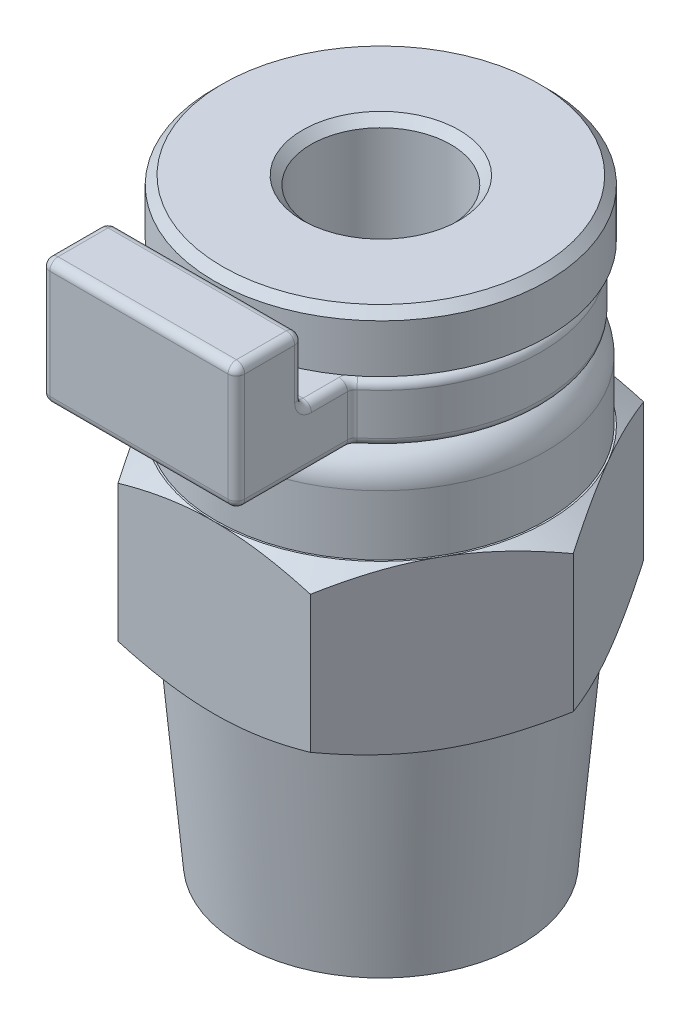
from build123d import *

# Parameters (mm, degrees)
BOSS_EXTRUDE1_DEPTH     = 2.5
SKETCH2_OUTSIDE_W       = 26.462
SKETCH2_OUTSIDE_H       = 24.914
SKETCH2_OUTSIDE_R       = 5
CUT_EXTRUDE4_DEPTH      = 2.8
CUT_EXTRUDE4_DRAFT      = -60
MIRROR1_COPY_1_SKETCH_W = 26.462
MIRROR1_COPY_1_SKETCH_H = 24.914
MIRROR1_COPY_1_SKETCH_R = 5
MIRROR1_COPY_1_DEPTH    = 2.8
MIRROR1_COPY_1_DRAFT    = -60
SKETCH3_R               = 4.95
BOSS_EXTRUDE2_DEPTH     = 2.8
FILLET1_R               = 1
SKETCH4_R               = 2.8
BOSS_EXTRUDE3_DEPTH     = 2
SKETCH6_R               = 5
BOSS_EXTRUDE4_DEPTH     = 1.7
SKETCH8_R               = 4.75
BOSS_EXTRUDE5_DEPTH     = 6.4
BOSS_EXTRUDE5_TAPER     = 5
SKETCH7_R               = 2.1
CUT_EXTRUDE5_DEPTH      = 20.461329269
CHAMFER1_SIZE           = 0.25
BOSS_EXTRUDE6_DEPTH     = 1.75
SKETCH10_W              = 5.85
SKETCH10_H              = 2
BOSS_EXTRUDE7_DEPTH     = 2
FILLET2_R               = 0.25


with BuildPart() as part:
    # Sketch1 → Boss-Extrude1 (new, symmetric)
    with BuildSketch(Plane(origin=(0, 0, 0), x_dir=(1, 0, 0), z_dir=(0, 1, 0))):
        Polygon((5.773502692, 0), (2.886751346, 5), (-2.886751346, 5), (-5.773502692, 0), (-2.886751346, -5), (2.886751346, -5), align=None)
    extrude(amount=BOSS_EXTRUDE1_DEPTH, both=True)


with BuildPart() as cut_extrude4_tool:
    # Sketch2 outside → Cut-Extrude4 (with draft: the straight prism first)
    with BuildSketch(Plane(origin=(0, 2.5, 0), x_dir=(1, 0, 0), z_dir=(0, 1, 0))):
        Rectangle(SKETCH2_OUTSIDE_W, SKETCH2_OUTSIDE_H)
        Circle(SKETCH2_OUTSIDE_R, mode=Mode.SUBTRACT)
    extrude(amount=-CUT_EXTRUDE4_DEPTH)
    # Cut-Extrude4: the draft: its side faces are tilted about the plane it starts from
    cut_extrude4_sides = [cut_extrude4_tool.faces().sort_by_distance(p)[0] for p in [
        (0, 1.1, 12.457),
        (13.231, 1.1, 0),
        (0, 1.1, -12.457),
        (-13.231, 1.1, 0),
        (-5, 1.1, 0),
    ]]
    draft(cut_extrude4_sides, Plane(origin=(0, 2.5, 0), x_dir=(1, 0, 0), z_dir=(0, 1, 0)), CUT_EXTRUDE4_DRAFT)


with BuildPart() as part_1:
    add(part.part)

    # Cut-Extrude4: cut by cut_extrude4_tool
    add(cut_extrude4_tool.part, mode=Mode.SUBTRACT)


with BuildPart() as mirror1_copy_1_tool:
    # Mirror1 copy 1 sketch → Mirror1 copy 1 (with draft: the straight prism first)
    with BuildSketch(Plane.XZ.offset(2.5)):
        Rectangle(MIRROR1_COPY_1_SKETCH_W, MIRROR1_COPY_1_SKETCH_H)
        Circle(MIRROR1_COPY_1_SKETCH_R, mode=Mode.SUBTRACT)
    extrude(amount=-MIRROR1_COPY_1_DEPTH)
    # Mirror1 copy 1: the draft: its side faces are tilted about the plane it starts from
    mirror1_copy_1_sides = [mirror1_copy_1_tool.faces().sort_by_distance(p)[0] for p in [
        (0, -1.1, 12.457),
        (13.231, -1.1, 0),
        (0, -1.1, -12.457),
        (-13.231, -1.1, 0),
        (-5, -1.1, 0),
    ]]
    draft(mirror1_copy_1_sides, Plane.XZ.offset(2.5), MIRROR1_COPY_1_DRAFT)


with BuildPart() as part_2:
    add(part_1.part)

    # Mirror1 copy 1: cut by mirror1_copy_1_tool
    add(mirror1_copy_1_tool.part, mode=Mode.SUBTRACT)

    # Sketch3 → Boss-Extrude2 (add)
    with BuildSketch(Plane(origin=(0, 2.5, 0), x_dir=(1, 0, 0), z_dir=(0, 1, 0))):
        with Locations(Location((0, 0, 0), (0, 0, 270))):
            Circle(SKETCH3_R)
    extrude(amount=BOSS_EXTRUDE2_DEPTH)

    # Fillet1
    fillet1_edges = [part_2.edges().sort_by_distance(p)[0] for p in [
        (0, 5.3, -4.95),
    ]]
    fillet(fillet1_edges, radius=FILLET1_R)

    # Sketch8 → Boss-Extrude5 (add)
    with BuildSketch(Plane.XZ.offset(2.5)):
        Circle(SKETCH8_R)
    extrude(amount=BOSS_EXTRUDE5_DEPTH, taper=BOSS_EXTRUDE5_TAPER)


with BuildPart() as body_2:
    # Sketch4 → Boss-Extrude3 (new body)
    with BuildSketch(Plane(origin=(0, 5.3, 0), x_dir=(1, 0, 0), z_dir=(0, 1, 0))):
        with Locations(Location((0, 0, 0), (0, 0, 270))):
            Circle(SKETCH4_R)
    extrude(amount=BOSS_EXTRUDE3_DEPTH)

    # Sketch6 → Boss-Extrude4 (add)
    with BuildSketch(Plane(origin=(0, 7.3, 0), x_dir=(1, 0, 0), z_dir=(0, 1, 0))):
        with Locations(Location((0, 0, 0), (0, 0, 270))):
            Circle(SKETCH6_R)
    extrude(amount=BOSS_EXTRUDE4_DEPTH)


with BuildPart() as cut_extrude5_tool:
    # Sketch7 → Cut-Extrude5 (new, through all)
    with BuildSketch(Plane(origin=(0, 9, 0), x_dir=(1, 0, 0), z_dir=(0, 1, 0))):
        with Locations(Location((0, 0, 0), (0, 0, 270))):
            Circle(SKETCH7_R)
    extrude(amount=-CUT_EXTRUDE5_DEPTH)


with BuildPart() as part_3:
    add(part_2.part)

    # Cut-Extrude5: cut by cut_extrude5_tool
    add(cut_extrude5_tool.part, mode=Mode.SUBTRACT)


with BuildPart() as body_2_1:
    add(body_2.part)

    # Cut-Extrude5: cut by cut_extrude5_tool
    add(cut_extrude5_tool.part, mode=Mode.SUBTRACT)

    # Chamfer1
    chamfer1_edges = [body_2_1.edges().sort_by_distance(p)[0] for p in [
        (0, 9, -2.1),
        (0, 9, -5),
    ]]
    chamfer(chamfer1_edges, length=CHAMFER1_SIZE)


with BuildPart() as body_3:
    # Sketch9 → Boss-Extrude6 (new body)
    with BuildSketch(Plane(origin=(0, 5.3, 0), x_dir=(1, 0, 0), z_dir=(0, 1, 0))):
        with BuildLine():
            Line((-2.25, 4.239988208), (-2.25, 1.666583331))
            ThreePointArc((-2.25, 1.666583331), (0, -2.8), (2.25, 1.666583331))
            Line((2.25, 1.666583331), (2.25, 4.239988208))
            ThreePointArc((2.25, 4.239988208), (4.783196771, 0.401283747), (2.925, -3.805834337))
            Line((2.925, -3.805834337), (2.925, -7.260011792))
            Line((2.925, -7.260011792), (-2.925, -7.260011792))
            Line((-2.925, -7.260011792), (-2.925, -3.805834337))
            ThreePointArc((-2.925, -3.805834337), (-4.783196771, 0.401283747), (-2.25, 4.239988208))
        make_face()
    extrude(amount=BOSS_EXTRUDE6_DEPTH)

    # Sketch10 → Boss-Extrude7 (add)
    with BuildSketch(Plane(origin=(0, 7.05, 0), x_dir=(1, 0, 0), z_dir=(0, 1, 0))):
        with Locations((0, -6.260011792)):
            Rectangle(SKETCH10_W, SKETCH10_H)
    extrude(amount=BOSS_EXTRUDE7_DEPTH)

    # Fillet2
    fillet2_edges = [body_3.edges().sort_by_distance(p)[0] for p in [
        (2.925, 5.3, 5.532923065),
        (0, 5.3, 7.260011792),
        (-2.925, 5.3, 5.532923065),
        (-4.783196771, 5.3, -0.401283747),
        (-2.25, 6.175, -4.239988208),
        (-2.25, 6.175, -1.666583331),
        (2.25, 6.175, -1.666583331),
        (2.25, 6.175, -4.239988208),
        (2.925, 6.175, 3.805834337),
        (2.925, 7.175, 7.260011792),
        (-2.925, 7.175, 7.260011792),
        (-2.925, 6.175, 3.805834337),
        (4.783196771, 7.05, -0.401283747),
        (2.25, 7.05, -2.953285769),
        (2.925, 7.05, 4.532923065),
        (-2.925, 8.05, 5.260011792),
        (0, 7.05, 5.260011792),
        (2.925, 8.05, 5.260011792),
        (-2.925, 9.05, 6.260011792),
        (0, 9.05, 7.260011792),
        (0, 7.05, 2.8),
        (2.925, 9.05, 6.260011792),
        (0, 9.05, 5.260011792),
        (-2.25, 7.05, -2.953285769),
        (-4.783196771, 7.05, -0.401283747),
        (-2.25, 5.3, -2.953285769),
        (-2.925, 7.05, 4.532923065),
        (0, 5.3, 2.8),
        (2.25, 5.3, -2.953285769),
        (4.783196771, 5.3, -0.401283747),
    ]]
    fillet(fillet2_edges, radius=FILLET2_R)


solid = Compound([part_3.part, body_2_1.part, body_3.part])
